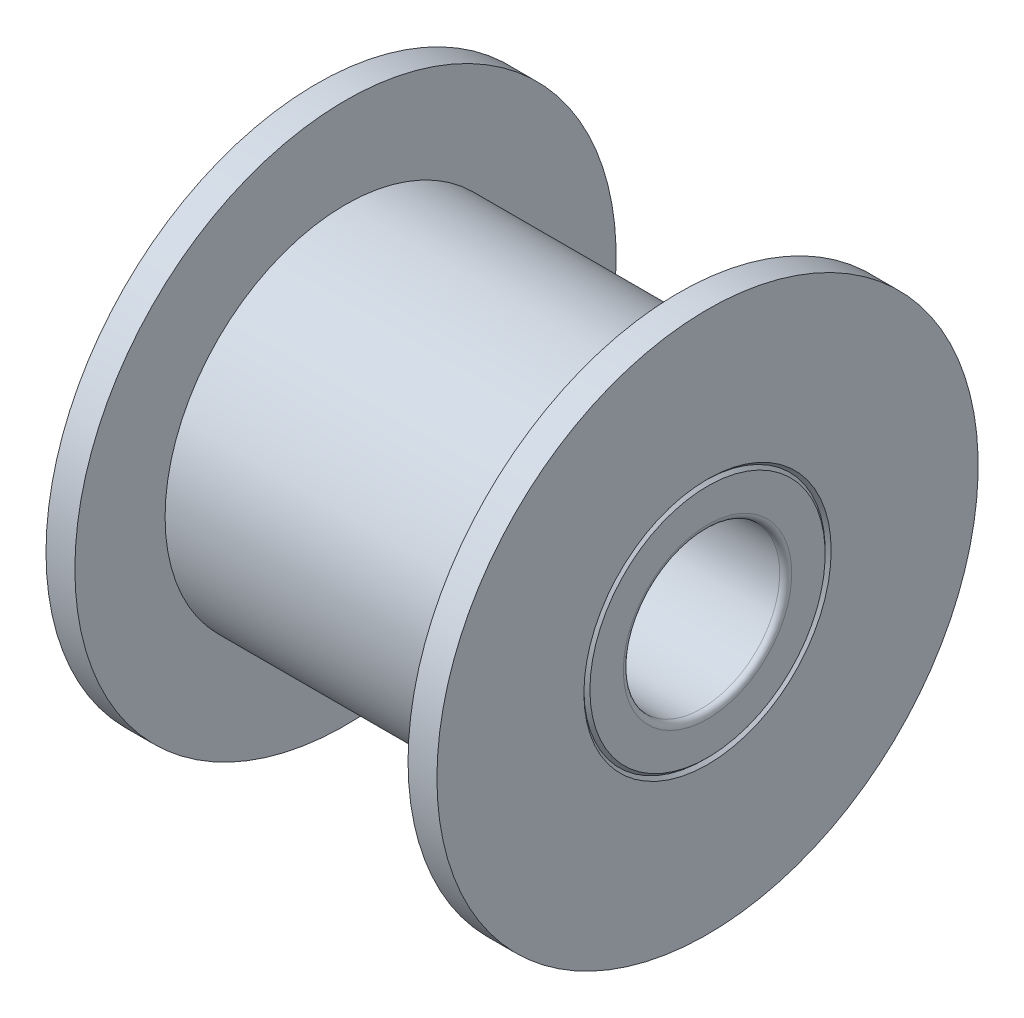
from build123d import *

# Parameters (mm, degrees)
FILLET1_R = 0.2


with BuildPart() as part:
    # Sketch 1 → Body (revolve)
    with BuildSketch(Plane.XY):
        Polygon((1.96, 7.5), (1, 7.5), (1, 2.611783382), (1.086628376, 2.5), (1, 2.388216618), (1, 1.1), (14, 1.1), (14, 2.411783382), (13.9, 2.511783382), (14, 2.611783382), (14, 7.5), (13.04, 7.5), (13.04, 4.5), (1.96, 4.5), align=None)
    revolve(axis=Axis((1, -1.5, 0), (1, 0, 0)))

    # Fillet1
    fillet1_edges = [part.edges().sort_by_distance(p)[0] for p in [
        (14, -4.1, 0),
        (1, -4.1, 0),
    ]]
    fillet(fillet1_edges, radius=FILLET1_R)


solid = part.part
